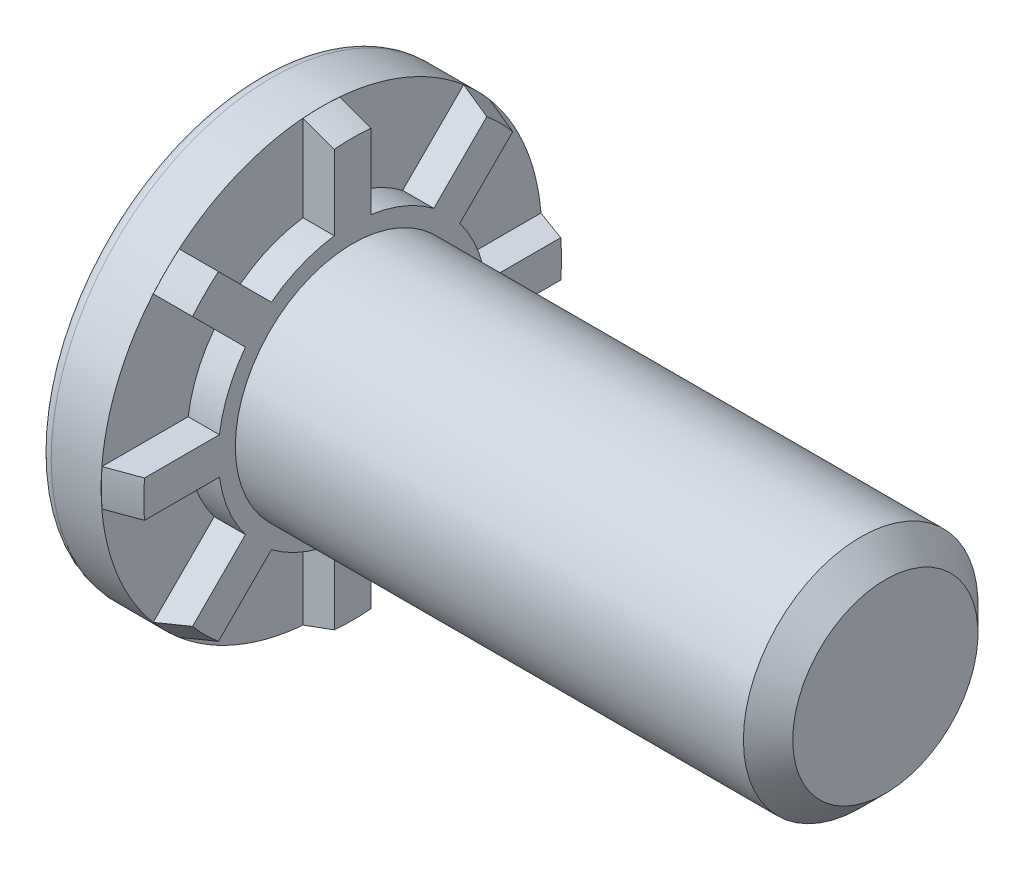
from build123d import *

# Parameters (mm, degrees)
RIBCUT_START     = -1.0541
RIBCUT_DEPTH     = 1.0541
RIBCUTSPAT_COUNT = 8
RIBCUTSPAT_ANGLE = 315


with BuildPart() as part:
    # BodySke → BaseBody (revolve)
    with BuildSketch(Plane.XY):
        with BuildLine():
            Line((-2.1082, 7.02056), (-2.1082, 0))
            Line((-2.1082, 0), (19.05, 0))
            Line((19.05, 0), (19.05, 3.12928))
            Line((19.05, 3.12928), (18.21688, 3.9624))
            Line((18.21688, 3.9624), (1.0541, 3.9624))
            Line((1.0541, 3.9624), (1.0541, 7.05692346))
            Line((1.0541, 7.05692346), (0.00254, 7.43966))
            Line((0.00254, 7.43966), (0, 7.43966))
            Line((0, 7.43966), (0, 7.4422))
            Line((0, 7.4422), (-1.68656, 7.4422))
            ThreePointArc((-1.68656, 7.4422), (-1.984704503, 7.318704503), (-2.1082, 7.02056))
        make_face()
    revolve(axis=Axis((0, 0, 0), (1, 0, 0)))

    # RibCutSke → RibCut (cut)
    with BuildSketch(Plane(origin=(1.0541, 1.794401132, -0.090952894), x_dir=(0, 0, -1), z_dir=(1, 0, 0)).offset(RIBCUT_START)):
        with BuildLine():
            Line((0.52890303, 2.705473707), (0.52890303, 5.621940248))
            ThreePointArc((0.52890303, 5.621940248), (2.757053746, 5.081295124), (4.71488806, 3.888048477))
            Line((4.71488806, 3.888048477), (2.652634792, 1.825795208))
            ThreePointArc((2.652634792, 1.825795208), (1.647335573, 2.40219846), (0.52890303, 2.705473707))
        make_face()
    ribcut = extrude(amount=RIBCUT_DEPTH, mode=Mode.SUBTRACT)

    # RibCutsPat: RibCut ×8 about axis
    ribcutspat_axis = Axis((0, 0, 0), (1, 0, 0))
    for i in range(1, RIBCUTSPAT_COUNT):
        add(ribcut.rotate(ribcutspat_axis, i * RIBCUTSPAT_ANGLE / (RIBCUTSPAT_COUNT - 1)), mode=Mode.SUBTRACT)


solid = part.part
